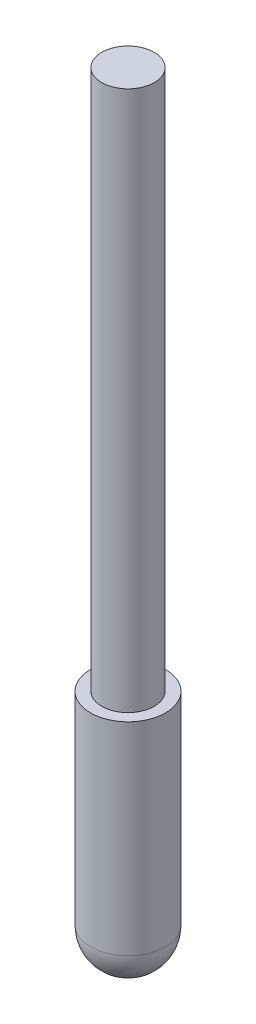
from build123d import *

# Parameters (mm, degrees)
SKETCH1_R           = 1.75
BOSS_EXTRUDE1_DEPTH = 36
SKETCH2_R           = 2.5
BOSS_EXTRUDE2_DEPTH = 16
FILLET1_R           = 2.5


with BuildPart() as part:
    # Sketch1 → Boss-Extrude1 (new body)
    with BuildSketch(Plane(origin=(0, 0, 0), x_dir=(1, 0, 0), z_dir=(0, 1, 0))):
        with Locations(Location((0, 0, 0), (0, 0, 270))):
            Circle(SKETCH1_R)
    extrude(amount=BOSS_EXTRUDE1_DEPTH)

    # Sketch2 → Boss-Extrude2 (add)
    with BuildSketch(Plane.XZ):
        with Locations(Location((0, 0, 0), (0, 0, 270))):
            Circle(SKETCH2_R)
    extrude(amount=BOSS_EXTRUDE2_DEPTH)

    # Fillet1
    fillet1_edges = [part.edges().sort_by_distance(p)[0] for p in [
        (0, -16, 2.5),
    ]]
    fillet(fillet1_edges, radius=FILLET1_R)


solid = part.part
